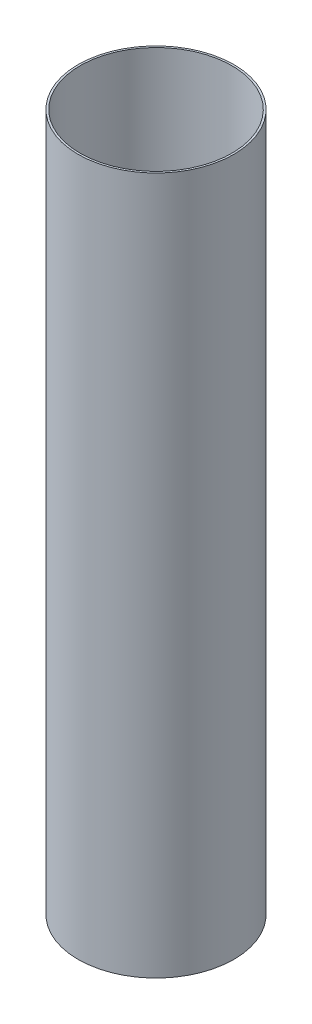
from build123d import *

# Parameters (mm, degrees)
SKETCH1_W = 1.96
SKETCH1_H = 700


with BuildPart() as part:
    # Sketch1 → Revolve1 (revolve)
    with BuildSketch(Plane.XY, mode=Mode.PRIVATE) as revolve1_sk:
        with Locations((77.18, 350)):
            Rectangle(SKETCH1_W, SKETCH1_H)
    revolve(revolve1_sk.sketch.rotate(Axis((0, 204.615384615, 0), (0, -1, 0)), 90), axis=Axis((0, 204.615384615, 0), (0, -1, 0)))


solid = part.part
